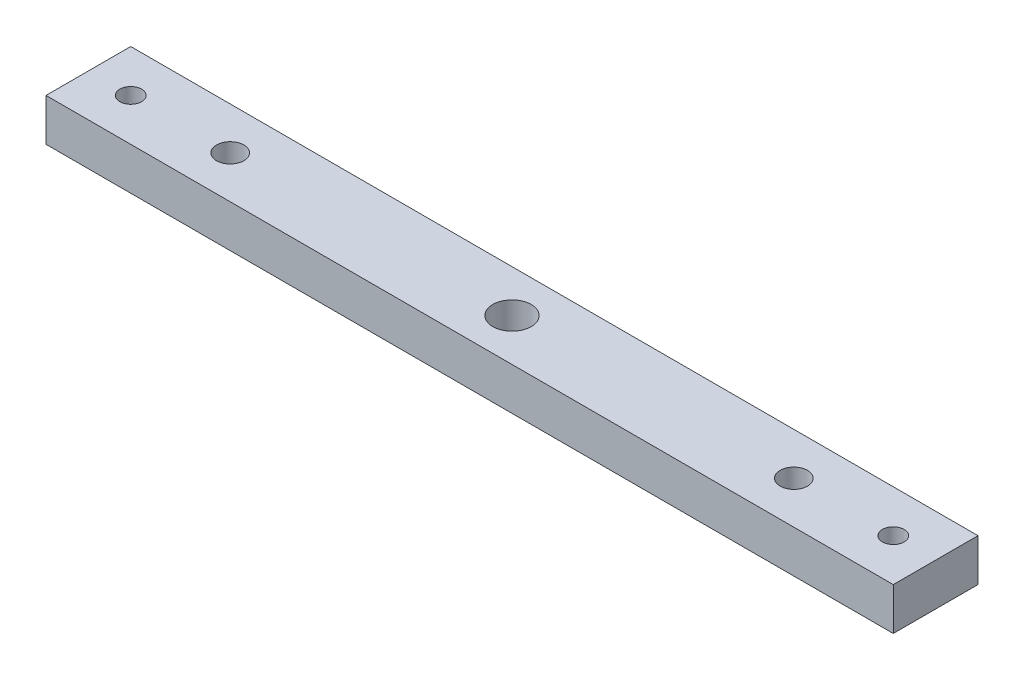
from build123d import *

# Parameters (mm, degrees)
SKETCH1_W                                        = 254
SKETCH1_H                                        = 25.4
BOSS_EXTRUDE1_DEPTH                              = 12.7
SKETCH2_R                                        = 5.08
F_1_2_20_THREAD_THRU_DEPTH                       = 256.582569828
SKETCH4_R                                        = 4.1021
CUT_EXTRUDE4_DEPTH                               = 256.582569828
CSK_FOR_1_4_FLAT_HEAD_MACHINE_SCREW1_D           = 6.5278
CSK_FOR_1_4_FLAT_HEAD_MACHINE_SCREW1_CSINK_D     = 12.8778
CSK_FOR_1_4_FLAT_HEAD_MACHINE_SCREW1_CSINK_ANGLE = 82
F_1_2_20_TAPPED_HOLE3_D                          = 11.50874


with BuildPart() as part:
    # Sketch1 → Boss-Extrude1 (new body)
    with BuildSketch(Plane(origin=(0, 0, 0), x_dir=(1, 0, 0), z_dir=(0, 1, 0))):
        with Locations((-127, 12.7)):
            Rectangle(SKETCH1_W, SKETCH1_H)
    extrude(amount=BOSS_EXTRUDE1_DEPTH)

    # Sketch2 → 1/2-20 thread thru (cut, through all)
    with BuildSketch(Plane(origin=(0, 12.7, 0), x_dir=(1, 0, 0), z_dir=(0, 1, 0))):
        with Locations((-127, 12.7)):
            Circle(SKETCH2_R)
    extrude(amount=-F_1_2_20_THREAD_THRU_DEPTH, mode=Mode.SUBTRACT)

    # Sketch4 → Cut-Extrude4 (cut, through all)
    with BuildSketch(Plane.XZ):
        with Locations(Location((-211.4804, -12.7, 0), (0, 0, 270))):
            Circle(SKETCH4_R)
        with Locations(Location((-42.5196, -12.7, 0), (0, 0, 270))):
            Circle(SKETCH4_R)
    extrude(amount=-CUT_EXTRUDE4_DEPTH, mode=Mode.SUBTRACT)

    # CSK for 1/4 Flat Head Machine Screw1 (through all)
    with Locations(Plane(origin=(0, 0, 0), x_dir=(-1, 0, 0), z_dir=(0, -1, 0))):
        with Locations((241.3, 12.7), (12.7, 12.7)):
            CounterSinkHole(CSK_FOR_1_4_FLAT_HEAD_MACHINE_SCREW1_D / 2, CSK_FOR_1_4_FLAT_HEAD_MACHINE_SCREW1_CSINK_D / 2, counter_sink_angle=CSK_FOR_1_4_FLAT_HEAD_MACHINE_SCREW1_CSINK_ANGLE)

    # 1/2-20 Tapped Hole3 (through all)
    with Locations(Plane(origin=(0, 12.7, 0), x_dir=(1, 0, 0), z_dir=(0, 1, 0))):
        with Locations((-127, 12.7)):
            Hole(F_1_2_20_TAPPED_HOLE3_D / 2)


solid = part.part
